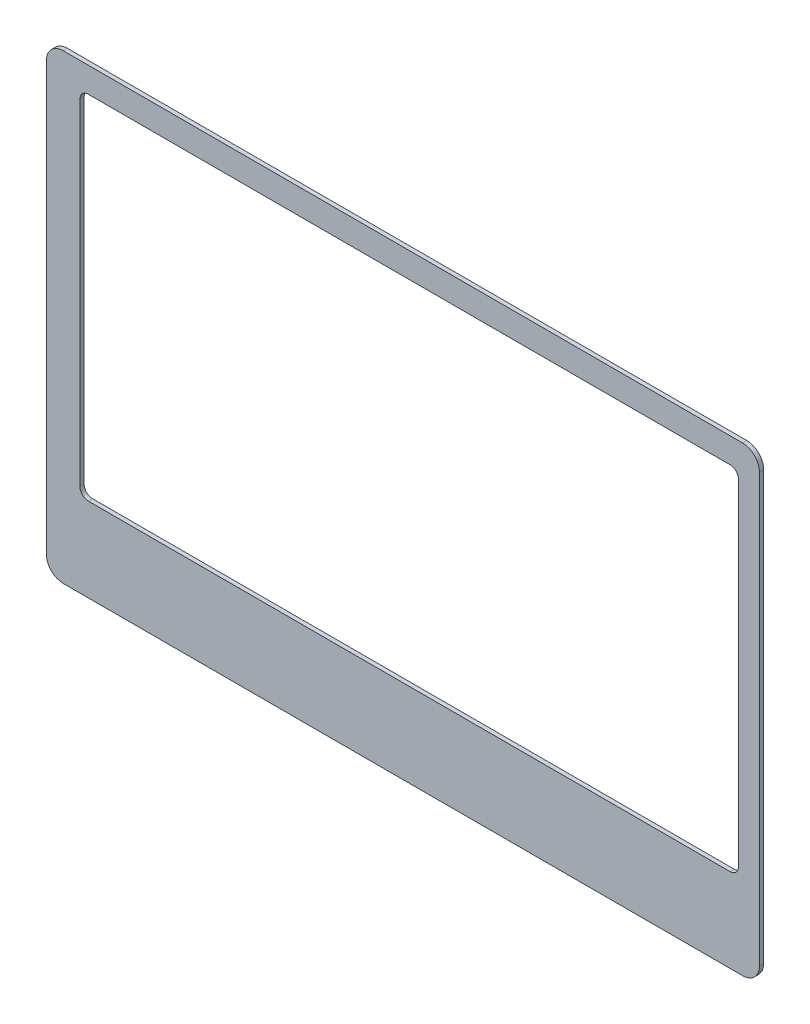
from build123d import *

# Parameters (mm, degrees)
SKETCH_1_W          = 85
SKETCH_1_H          = 55
EXTRUDE_1_DEPTH     = 0.5
CUT_EXTRUDE_1_REACH = 52.624
FILLET_1_R          = 2


with BuildPart() as part:
    # 草图1 → 凸台-拉伸1 (new body)
    with BuildSketch(Plane.XY):
        Rectangle(SKETCH_1_W, SKETCH_1_H)
    extrude(amount=EXTRUDE_1_DEPTH)

    # 草图2 → 切除-拉伸1 (cut, up to next)
    with BuildSketch(Plane.XY.offset(0.5), mode=Mode.PRIVATE) as cut_extrude_1_sk1:
        with BuildLine():
            Line((-37.5, 24.5), (39, 24.5))
            ThreePointArc((39, 24.5), (39.707106781, 24.207106781), (40, 23.5))
            Line((40, 23.5), (40, -16.5))
            ThreePointArc((40, -16.5), (39.707106781, -17.207106781), (39, -17.5))
            Line((39, -17.5), (-37.5, -17.5))
            ThreePointArc((-37.5, -17.5), (-38.207106781, -17.207106781), (-38.5, -16.5))
            Line((-38.5, -16.5), (-38.5, 23.5))
            ThreePointArc((-38.5, 23.5), (-38.207106781, 24.207106781), (-37.5, 24.5))
        make_face()
    cut_extrude_1_tool1 = extrude(cut_extrude_1_sk1.sketch, amount=-CUT_EXTRUDE_1_REACH, mode=Mode.PRIVATE) & part.part
    add(cut_extrude_1_tool1.solids().sort_by_distance((0.75, 3.5, 0.5))[0], mode=Mode.SUBTRACT)

    # 圆角1
    fillet_1_edges = [part.edges().sort_by_distance(p)[0] for p in [
        (42.5, -27.5, 0.25),
        (-42.5, -27.5, 0.25),
        (-42.5, 27.5, 0.25),
        (42.5, 27.5, 0.25),
    ]]
    fillet(fillet_1_edges, radius=FILLET_1_R)


solid = part.part
